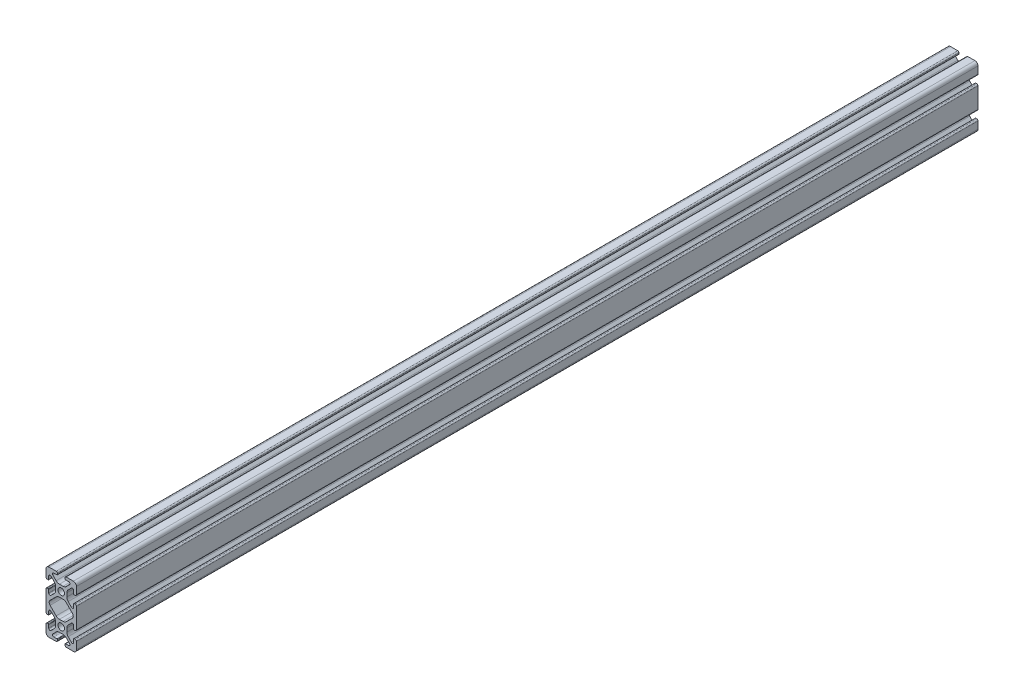
from build123d import *

# Parameters (mm, degrees)
SKETCH3_R           = 2.15
BOSS_EXTRUDE1_DEPTH = 304.8
CIRPATTERN1_COUNT   = 2
SKETCH4_R           = 2.15
CUT_EXTRUDE1_DEPTH  = 17.07


with BuildPart() as part:
    # Sketch3 → Boss-Extrude1 (new, symmetric)
    with BuildSketch(Plane.XY):
        with BuildLine():
            Line((-8.5, 7.5), (-9.2, 7.5))
            ThreePointArc((-9.2, 7.5), (-9.765685425, 7.265685425), (-10, 6.7))
            Line((-10, 6.7), (-10, 0))
            Line((-10, 0), (-7.916458339, 0))
            ThreePointArc((-7.916458339, 0), (-7.764217404, 0.765366865), (-7.330671901, 1.414213562))
            Line((-7.330671901, 1.414213562), (-3.32356512, 5.421320344))
            ThreePointArc((-3.32356512, 5.421320344), (-2.350295073, 6.071638598), (-1.202244776, 6.3))
            Line((-1.202244776, 6.3), (1.202244776, 6.3))
            ThreePointArc((1.202244776, 6.3), (2.350295073, 6.071638598), (3.32356512, 5.421320344))
            Line((3.32356512, 5.421320344), (7.330671901, 1.414213562))
            ThreePointArc((7.330671901, 1.414213562), (7.764217404, 0.765366865), (7.916458339, 0))
            Line((7.916458339, 0), (10, 0))
            Line((10, 0), (10, 6.7))
            ThreePointArc((10, 6.7), (9.765685425, 7.265685425), (9.2, 7.5))
            Line((9.2, 7.5), (8.5, 7.5))
            ThreePointArc((8.5, 7.5), (8.287867966, 7.412132034), (8.2, 7.2))
            Line((8.2, 7.2), (8.2, 5.094911614))
            ThreePointArc((8.2, 5.094911614), (7.678422063, 4.314315067), (6.757645654, 4.497468882))
            Line((6.757645654, 4.497468882), (4.578679656, 6.67643488))
            ThreePointArc((4.578679656, 6.67643488), (3.928361402, 7.649704927), (3.7, 8.797755224))
            Line((3.7, 8.797755224), (3.7, 11.202244776))
            ThreePointArc((3.7, 11.202244776), (3.928361402, 12.350295073), (4.578679656, 13.32356512))
            Line((4.578679656, 13.32356512), (6.757645654, 15.502531118))
            ThreePointArc((6.757645654, 15.502531118), (7.678422063, 15.685684933), (8.2, 14.905088386))
            Line((8.2, 14.905088386), (8.2, 12.8))
            ThreePointArc((8.2, 12.8), (8.287867966, 12.587867966), (8.5, 12.5))
            Line((8.5, 12.5), (9.2, 12.5))
            ThreePointArc((9.2, 12.5), (9.765685425, 12.734314575), (10, 13.3))
            Line((10, 13.3), (10, 18))
            ThreePointArc((10, 18), (9.414213562, 19.414213562), (8, 20))
            Line((8, 20), (3.3, 20))
            ThreePointArc((3.3, 20), (2.734314575, 19.765685425), (2.5, 19.2))
            Line((2.5, 19.2), (2.5, 18.5))
            ThreePointArc((2.5, 18.5), (2.587867966, 18.287867966), (2.8, 18.2))
            Line((2.8, 18.2), (4.905088386, 18.2))
            ThreePointArc((4.905088386, 18.2), (5.685684933, 17.678422063), (5.502531118, 16.757645654))
            Line((5.502531118, 16.757645654), (3.32356512, 14.578679656))
            ThreePointArc((3.32356512, 14.578679656), (2.350295073, 13.928361402), (1.202244776, 13.7))
            Line((1.202244776, 13.7), (-1.202244776, 13.7))
            ThreePointArc((-1.202244776, 13.7), (-2.350295073, 13.928361402), (-3.32356512, 14.578679656))
            Line((-3.32356512, 14.578679656), (-5.502531118, 16.757645654))
            ThreePointArc((-5.502531118, 16.757645654), (-5.685684933, 17.678422063), (-4.905088386, 18.2))
            Line((-4.905088386, 18.2), (-2.8, 18.2))
            ThreePointArc((-2.8, 18.2), (-2.587867966, 18.287867966), (-2.5, 18.5))
            Line((-2.5, 18.5), (-2.5, 19.2))
            ThreePointArc((-2.5, 19.2), (-2.734314575, 19.765685425), (-3.3, 20))
            Line((-3.3, 20), (-8, 20))
            ThreePointArc((-8, 20), (-9.414213562, 19.414213562), (-10, 18))
            Line((-10, 18), (-10, 13.3))
            ThreePointArc((-10, 13.3), (-9.765685425, 12.734314575), (-9.2, 12.5))
            Line((-9.2, 12.5), (-8.5, 12.5))
            ThreePointArc((-8.5, 12.5), (-8.287867966, 12.587867966), (-8.2, 12.8))
            Line((-8.2, 12.8), (-8.2, 14.905088386))
            ThreePointArc((-8.2, 14.905088386), (-7.678422063, 15.685684933), (-6.757645654, 15.502531118))
            Line((-6.757645654, 15.502531118), (-4.578679656, 13.32356512))
            ThreePointArc((-4.578679656, 13.32356512), (-3.928361402, 12.350295073), (-3.7, 11.202244776))
            Line((-3.7, 11.202244776), (-3.7, 8.797755224))
            ThreePointArc((-3.7, 8.797755224), (-3.928361402, 7.649704927), (-4.578679656, 6.67643488))
            Line((-4.578679656, 6.67643488), (-6.757645654, 4.497468882))
            ThreePointArc((-6.757645654, 4.497468882), (-7.678422063, 4.314315067), (-8.2, 5.094911614))
            Line((-8.2, 5.094911614), (-8.2, 7.2))
            ThreePointArc((-8.2, 7.2), (-8.287867966, 7.412132034), (-8.5, 7.5))
        make_face()
        with Locations(Location((0, 10, 0), (0, 0, 180))):
            Circle(SKETCH3_R, mode=Mode.SUBTRACT)
    boss_extrude1 = extrude(amount=BOSS_EXTRUDE1_DEPTH, both=True)

    # CirPattern1: Boss-Extrude1 ×2 about axis
    cirpattern1_axis = Axis((0, 0, 0), (0, 0, 1))
    for i in range(1, CIRPATTERN1_COUNT):
        add(boss_extrude1.rotate(cirpattern1_axis, i * 360 / CIRPATTERN1_COUNT))

    # Sketch4 → Cut-Extrude1 (cut)
    with BuildSketch(Plane.XY.offset(304.8)):
        with BuildLine():
            Line((-2.5, 18.5), (-2.5, 19.2))
            ThreePointArc((-2.5, 19.2), (-2.734314575, 19.765685425), (-3.3, 20))
            Line((-3.3, 20), (-8, 20))
            ThreePointArc((-8, 20), (-9.414213562, 19.414213562), (-10, 18))
            Line((-10, 18), (-10, 13.3))
            ThreePointArc((-10, 13.3), (-9.765685425, 12.734314575), (-9.2, 12.5))
            Line((-9.2, 12.5), (-8.5, 12.5))
            ThreePointArc((-8.5, 12.5), (-8.287867966, 12.587867966), (-8.2, 12.8))
            Line((-8.2, 12.8), (-8.2, 14.905088386))
            ThreePointArc((-8.2, 14.905088386), (-7.678422063, 15.685684933), (-6.757645654, 15.502531118))
            Line((-6.757645654, 15.502531118), (-4.578679656, 13.32356512))
            ThreePointArc((-4.578679656, 13.32356512), (-3.928361402, 12.350295073), (-3.7, 11.202244776))
            Line((-3.7, 11.202244776), (-3.7, 8.797755224))
            ThreePointArc((-3.7, 8.797755224), (-3.928361402, 7.649704927), (-4.578679656, 6.67643488))
            Line((-4.578679656, 6.67643488), (-6.757645654, 4.497468882))
            ThreePointArc((-6.757645654, 4.497468882), (-7.678422063, 4.314315067), (-8.2, 5.094911614))
            Line((-8.2, 5.094911614), (-8.2, 7.2))
            ThreePointArc((-8.2, 7.2), (-8.287867966, 7.412132034), (-8.5, 7.5))
            Line((-8.5, 7.5), (-9.2, 7.5))
            ThreePointArc((-9.2, 7.5), (-9.765685425, 7.265685425), (-10, 6.7))
            Line((-10, 6.7), (-10, -6.7))
            ThreePointArc((-10, -6.7), (-9.765685425, -7.265685425), (-9.2, -7.5))
            Line((-9.2, -7.5), (-8.5, -7.5))
            ThreePointArc((-8.5, -7.5), (-8.287867966, -7.412132034), (-8.2, -7.2))
            Line((-8.2, -7.2), (-8.2, -5.094911614))
            ThreePointArc((-8.2, -5.094911614), (-7.678422063, -4.314315067), (-6.757645654, -4.497468882))
            Line((-6.757645654, -4.497468882), (-4.578679656, -6.67643488))
            ThreePointArc((-4.578679656, -6.67643488), (-3.928361402, -7.649704927), (-3.7, -8.797755224))
            Line((-3.7, -8.797755224), (-3.7, -11.202244776))
            ThreePointArc((-3.7, -11.202244776), (-3.928361402, -12.350295073), (-4.578679656, -13.32356512))
            Line((-4.578679656, -13.32356512), (-6.757645654, -15.502531118))
            ThreePointArc((-6.757645654, -15.502531118), (-7.678422063, -15.685684933), (-8.2, -14.905088386))
            Line((-8.2, -14.905088386), (-8.2, -12.8))
            ThreePointArc((-8.2, -12.8), (-8.287867966, -12.587867966), (-8.5, -12.5))
            Line((-8.5, -12.5), (-9.2, -12.5))
            ThreePointArc((-9.2, -12.5), (-9.765685425, -12.734314575), (-10, -13.3))
            Line((-10, -13.3), (-10, -18))
            ThreePointArc((-10, -18), (-9.414213562, -19.414213562), (-8, -20))
            Line((-8, -20), (-3.3, -20))
            ThreePointArc((-3.3, -20), (-2.734314575, -19.765685425), (-2.5, -19.2))
            Line((-2.5, -19.2), (-2.5, -18.5))
            ThreePointArc((-2.5, -18.5), (-2.587867966, -18.287867966), (-2.8, -18.2))
            Line((-2.8, -18.2), (-4.905088386, -18.2))
            ThreePointArc((-4.905088386, -18.2), (-5.685684933, -17.678422063), (-5.502531118, -16.757645654))
            Line((-5.502531118, -16.757645654), (-3.32356512, -14.578679656))
            ThreePointArc((-3.32356512, -14.578679656), (-2.350295073, -13.928361402), (-1.202244776, -13.7))
            Line((-1.202244776, -13.7), (1.202244776, -13.7))
            ThreePointArc((1.202244776, -13.7), (2.350295073, -13.928361402), (3.32356512, -14.578679656))
            Line((3.32356512, -14.578679656), (5.502531118, -16.757645654))
            ThreePointArc((5.502531118, -16.757645654), (5.685684933, -17.678422063), (4.905088386, -18.2))
            Line((4.905088386, -18.2), (2.8, -18.2))
            ThreePointArc((2.8, -18.2), (2.587867966, -18.287867966), (2.5, -18.5))
            Line((2.5, -18.5), (2.5, -19.2))
            ThreePointArc((2.5, -19.2), (2.734314575, -19.765685425), (3.3, -20))
            Line((3.3, -20), (8, -20))
            ThreePointArc((8, -20), (9.414213562, -19.414213562), (10, -18))
            Line((10, -18), (10, -13.3))
            ThreePointArc((10, -13.3), (9.765685425, -12.734314575), (9.2, -12.5))
            Line((9.2, -12.5), (8.5, -12.5))
            ThreePointArc((8.5, -12.5), (8.287867966, -12.587867966), (8.2, -12.8))
            Line((8.2, -12.8), (8.2, -14.905088386))
            ThreePointArc((8.2, -14.905088386), (7.678422063, -15.685684933), (6.757645654, -15.502531118))
            Line((6.757645654, -15.502531118), (4.578679656, -13.32356512))
            ThreePointArc((4.578679656, -13.32356512), (3.928361402, -12.350295073), (3.7, -11.202244776))
            Line((3.7, -11.202244776), (3.7, -8.797755224))
            ThreePointArc((3.7, -8.797755224), (3.928361402, -7.649704927), (4.578679656, -6.67643488))
            Line((4.578679656, -6.67643488), (6.757645654, -4.497468882))
            ThreePointArc((6.757645654, -4.497468882), (7.678422063, -4.314315067), (8.2, -5.094911614))
            Line((8.2, -5.094911614), (8.2, -7.2))
            ThreePointArc((8.2, -7.2), (8.287867966, -7.412132034), (8.5, -7.5))
            Line((8.5, -7.5), (9.2, -7.5))
            ThreePointArc((9.2, -7.5), (9.765685425, -7.265685425), (10, -6.7))
            Line((10, -6.7), (10, 6.7))
            ThreePointArc((10, 6.7), (9.765685425, 7.265685425), (9.2, 7.5))
            Line((9.2, 7.5), (8.5, 7.5))
            ThreePointArc((8.5, 7.5), (8.287867966, 7.412132034), (8.2, 7.2))
            Line((8.2, 7.2), (8.2, 5.094911614))
            ThreePointArc((8.2, 5.094911614), (7.678422063, 4.314315067), (6.757645654, 4.497468882))
            Line((6.757645654, 4.497468882), (4.578679656, 6.67643488))
            ThreePointArc((4.578679656, 6.67643488), (3.928361402, 7.649704927), (3.7, 8.797755224))
            Line((3.7, 8.797755224), (3.7, 11.202244776))
            ThreePointArc((3.7, 11.202244776), (3.928361402, 12.350295073), (4.578679656, 13.32356512))
            Line((4.578679656, 13.32356512), (6.757645654, 15.502531118))
            ThreePointArc((6.757645654, 15.502531118), (7.678422063, 15.685684933), (8.2, 14.905088386))
            Line((8.2, 14.905088386), (8.2, 12.8))
            ThreePointArc((8.2, 12.8), (8.287867966, 12.587867966), (8.5, 12.5))
            Line((8.5, 12.5), (9.2, 12.5))
            ThreePointArc((9.2, 12.5), (9.765685425, 12.734314575), (10, 13.3))
            Line((10, 13.3), (10, 18))
            ThreePointArc((10, 18), (9.414213562, 19.414213562), (8, 20))
            Line((8, 20), (3.3, 20))
            ThreePointArc((3.3, 20), (2.734314575, 19.765685425), (2.5, 19.2))
            Line((2.5, 19.2), (2.5, 18.5))
            ThreePointArc((2.5, 18.5), (2.587867966, 18.287867966), (2.8, 18.2))
            Line((2.8, 18.2), (4.905088386, 18.2))
            ThreePointArc((4.905088386, 18.2), (5.685684933, 17.678422063), (5.502531118, 16.757645654))
            Line((5.502531118, 16.757645654), (3.32356512, 14.578679656))
            ThreePointArc((3.32356512, 14.578679656), (2.350295073, 13.928361402), (1.202244776, 13.7))
            Line((1.202244776, 13.7), (-1.202244776, 13.7))
            ThreePointArc((-1.202244776, 13.7), (-2.350295073, 13.928361402), (-3.32356512, 14.578679656))
            Line((-3.32356512, 14.578679656), (-5.502531118, 16.757645654))
            ThreePointArc((-5.502531118, 16.757645654), (-5.685684933, 17.678422063), (-4.905088386, 18.2))
            Line((-4.905088386, 18.2), (-2.8, 18.2))
            ThreePointArc((-2.8, 18.2), (-2.587867966, 18.287867966), (-2.5, 18.5))
        make_face()
        with Locations(Location((0, 10, 0), (0, 0, 180))):
            Circle(SKETCH4_R, mode=Mode.SUBTRACT)
        with Locations(Location((0, -10, 0), (0, 0, 90))):
            Circle(SKETCH4_R, mode=Mode.SUBTRACT)
        with BuildLine():
            Line((7.330671901, -1.414213562), (3.32356512, -5.421320344))
            ThreePointArc((3.32356512, -5.421320344), (2.350295073, -6.071638598), (1.202244776, -6.3))
            Line((1.202244776, -6.3), (-1.202244776, -6.3))
            ThreePointArc((-1.202244776, -6.3), (-2.350295073, -6.071638598), (-3.32356512, -5.421320344))
            Line((-3.32356512, -5.421320344), (-7.330671901, -1.414213562))
            ThreePointArc((-7.330671901, -1.414213562), (-7.916458339, 0), (-7.330671901, 1.414213562))
            Line((-7.330671901, 1.414213562), (-3.32356512, 5.421320344))
            ThreePointArc((-3.32356512, 5.421320344), (-2.350295073, 6.071638598), (-1.202244776, 6.3))
            Line((-1.202244776, 6.3), (1.202244776, 6.3))
            ThreePointArc((1.202244776, 6.3), (2.350295073, 6.071638598), (3.32356512, 5.421320344))
            Line((3.32356512, 5.421320344), (7.330671901, 1.414213562))
            ThreePointArc((7.330671901, 1.414213562), (7.916458339, 0), (7.330671901, -1.414213562))
        make_face(mode=Mode.SUBTRACT)
    extrude(amount=-CUT_EXTRUDE1_DEPTH, mode=Mode.SUBTRACT)


solid = part.part
